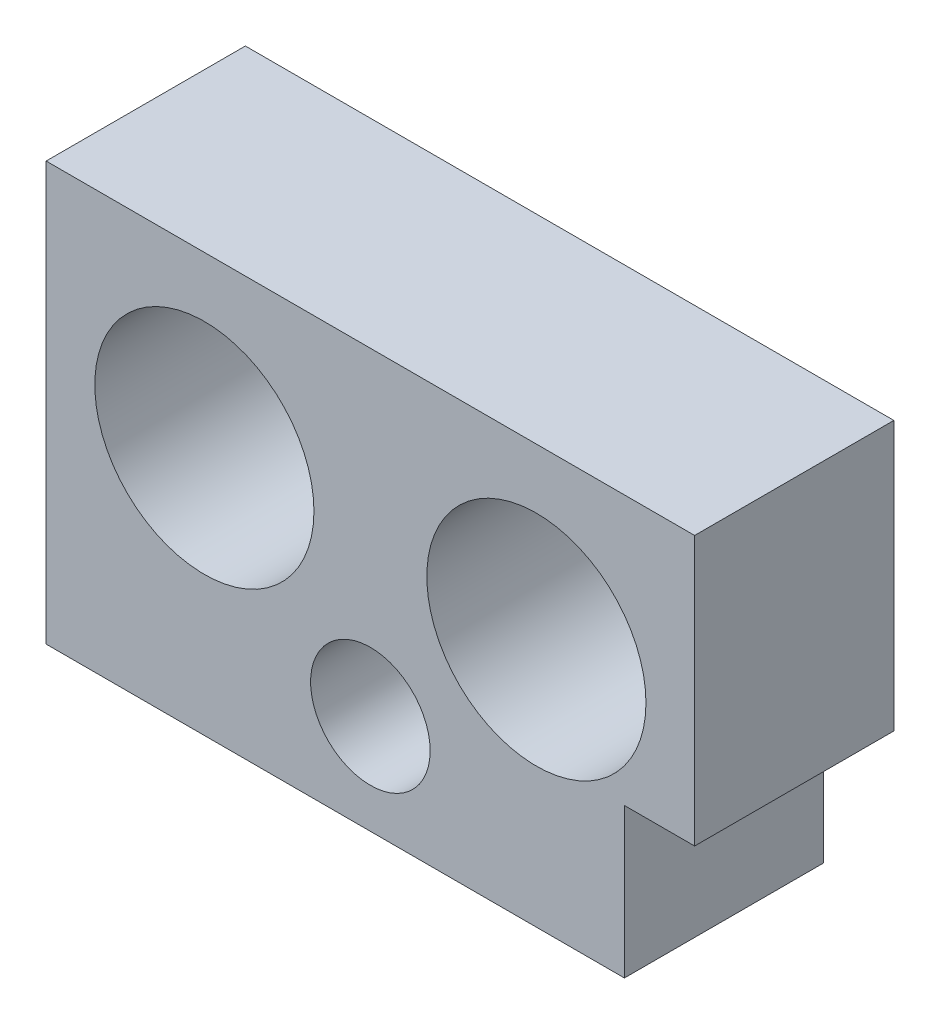
from build123d import *

# Parameters (mm, degrees)
PARALLELEPIPEDOBLOCCO_DEPTH  = 20
SCHIZZO2_R                   = 11
SCHIZZO2_R_2                 = 6
FORITUBIMOTORI_DEPTH         = 46.656352242
SCHIZZO3_W                   = 7.05
SCHIZZO3_H                   = 15
SPAZIOMOVIMENTOLEVETTA_DEPTH = 46.656352242


with BuildPart() as part:
    # Schizzo1 → ParallelepipedoBlocco (new body)
    with BuildSketch(Plane.XY):
        Polygon((-30.55, -25), (30.55, -25), (32.55, -25), (32.55, 17), (-32.55, 17), (-32.55, -25), align=None)
    extrude(amount=PARALLELEPIPEDOBLOCCO_DEPTH)

    # Schizzo2 → ForiTubiMotori (cut, through all)
    with BuildSketch(Plane.XY.offset(20)):
        with Locations((-16.665, 0)):
            Circle(SCHIZZO2_R)
        with Locations((16.665, 0)):
            Circle(SCHIZZO2_R)
        with Locations((0, -15)):
            Circle(SCHIZZO2_R_2)
    extrude(amount=-FORITUBIMOTORI_DEPTH, mode=Mode.SUBTRACT)

    # Schizzo3 → SpazioMovimentoLevetta (cut, through all)
    with BuildSketch(Plane.XY.offset(20)):
        with Locations((29.025, -17.5)):
            Rectangle(SCHIZZO3_W, SCHIZZO3_H)
    extrude(amount=-SPAZIOMOVIMENTOLEVETTA_DEPTH, mode=Mode.SUBTRACT)


solid = part.part
